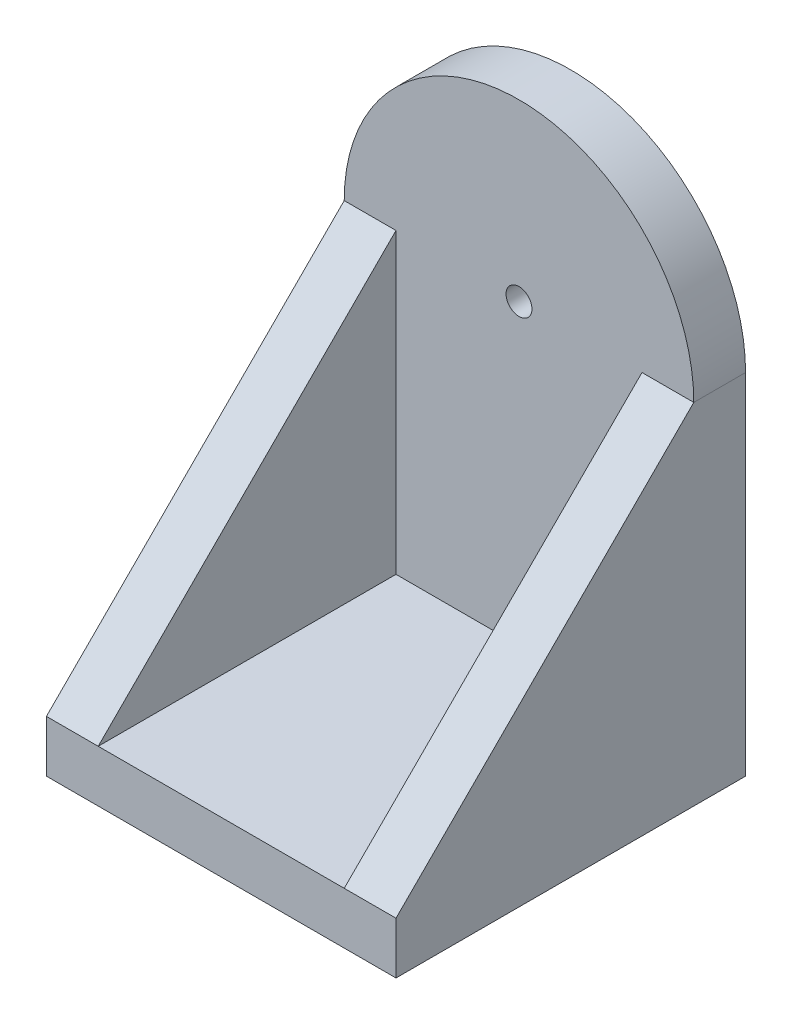
from build123d import *

# Parameters (mm, degrees)
SKETCH1_R           = 5
BOSS_EXTRUDE1_DEPTH = 20
BOSS_EXTRUDE2_DEPTH = 20
SKETCH6_W           = 95
SKETCH6_H           = 20
BOSS_EXTRUDE3_DEPTH = 115


with BuildPart() as part:
    # Sketch1 → Boss-Extrude1 (new body)
    with BuildSketch(Plane.XY):
        with BuildLine():
            Line((-67.5, -135), (-67.5, 0))
            ThreePointArc((-67.5, 0), (0, 67.5), (67.5, 0))
            Line((67.5, 0), (67.5, -135))
            Line((67.5, -135), (-67.5, -135))
        make_face()
        Circle(SKETCH1_R, mode=Mode.SUBTRACT)
    extrude(amount=BOSS_EXTRUDE1_DEPTH)

    # Sketch5 → Boss-Extrude2 (add)
    with BuildSketch(Plane(origin=(67.5, 0, 0), x_dir=(0, 0, -1), z_dir=(1, 0, 0))):
        Polygon((-20, 0), (-135, -115), (-135, -135), (-20, -135), align=None)
    boss_extrude2 = extrude(amount=-BOSS_EXTRUDE2_DEPTH)

    # Mirror1: Boss-Extrude2 across plane
    add(boss_extrude2.mirror(Plane(origin=(0, 0, 0), x_dir=(0, 0, 1), z_dir=(1, 0, 0))))

    # Sketch6 → Boss-Extrude3 (add)
    with BuildSketch(Plane.XY.offset(20)):
        with Locations((0, -125)):
            Rectangle(SKETCH6_W, SKETCH6_H)
    extrude(amount=BOSS_EXTRUDE3_DEPTH)


solid = part.part
